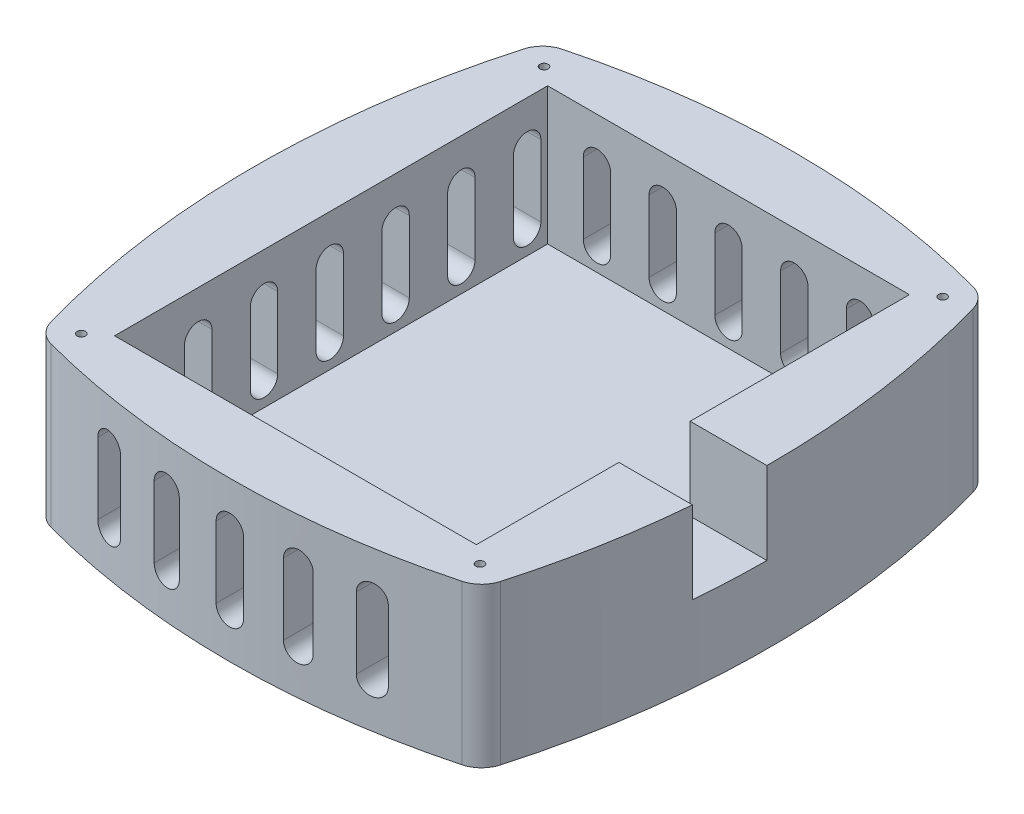
from build123d import *
from build123d.topology import SkipClean

# Parameters (mm, degrees)
SKETCH1_W                       = 66
SKETCH1_H                       = 79
BOSS_EXTRUDE1_DEPTH             = 4
SKETCH2_W                       = 74
SKETCH2_H                       = 87
SKETCH2_W_2                     = 66
SKETCH2_H_2                     = 79
BOSS_EXTRUDE2_DEPTH             = 29
SKETCH4_W                       = 74
SKETCH4_H                       = 87
BOSS_EXTRUDE4_DEPTH             = 29
SKETCH3_W                       = 16.198797776
SKETCH3_H                       = 13
CUT_EXTRUDE1_DEPTH              = 15
CUT_EXTRUDE2_DEPTH              = 93
CUT_EXTRUDE3_DEPTH              = 93
LPATTERN1_COUNT                 = 3
LPATTERN1_PITCH                 = 12
LPATTERN1_COL_COUNT             = 3
LPATTERN1_COL_PITCH             = 12
MIRROR1_COPY_1_DEPTH            = 93
MIRROR1_COPY_2_DEPTH            = 93
MIRROR1_COPY_3_DEPTH            = 93
MIRROR1_COPY_4_DEPTH            = 93
F_17_0_173_DIAMETER_HOLE1_D     = 1.500000048
F_17_0_173_DIAMETER_HOLE1_DEPTH = 10
F_17_0_173_DIAMETER_HOLE1_TIP   = 0.450645479


with BuildPart() as part:
    # Sketch1 → Boss-Extrude1 (new body)
    with BuildSketch(Plane(origin=(0, 0, 0), x_dir=(1, 0, 0), z_dir=(0, 1, 0))):
        with Locations((6.247484464, 10.574483927)):
            Rectangle(SKETCH1_W, SKETCH1_H)
    extrude(amount=BOSS_EXTRUDE1_DEPTH)

    # Sketch2 → Boss-Extrude2 (add)
    with BuildSketch(Plane.XZ):
        with Locations((6.247484464, -10.574483927)):
            Rectangle(SKETCH2_W, SKETCH2_H)
        with Locations((6.247484464, -10.574483927)):
            Rectangle(SKETCH2_W_2, SKETCH2_H_2, mode=Mode.SUBTRACT)
    extrude(amount=-BOSS_EXTRUDE2_DEPTH)

    # Sketch4 → Boss-Extrude4 (add)
    with BuildSketch(Plane.XZ):
        with BuildLine():
            ThreePointArc((-40.752515536, -10.574483927), (-39.245325003, 11.194253659), (-34.752515536, 32.547572429))
            ThreePointArc((-34.752515536, 32.547572429), (-33.449793102, 34.746088639), (-31.230871017, 36.013741608))
            ThreePointArc((-31.230871017, 36.013741608), (-12.651937868, 39.692344544), (6.247484464, 40.925516073))
            ThreePointArc((6.247484464, 40.925516073), (25.146906796, 39.692344544), (43.725839944, 36.013741608))
            ThreePointArc((43.725839944, 36.013741608), (45.944762029, 34.746088639), (47.247484464, 32.547572429))
            ThreePointArc((47.247484464, 32.547572429), (51.740293931, 11.194253659), (53.247484464, -10.574483927))
            ThreePointArc((53.247484464, -10.574483927), (51.740293931, -32.343221514), (47.247484464, -53.696540284))
            ThreePointArc((47.247484464, -53.696540284), (45.944762029, -55.895056494), (43.725839944, -57.162709463))
            ThreePointArc((43.725839944, -57.162709463), (25.146906796, -60.841312399), (6.247484464, -62.074483927))
            ThreePointArc((6.247484464, -62.074483927), (-12.651937868, -60.841312399), (-31.230871017, -57.162709463))
            ThreePointArc((-31.230871017, -57.162709463), (-33.449793102, -55.895056494), (-34.752515536, -53.696540284))
            ThreePointArc((-34.752515536, -53.696540284), (-39.245325003, -32.343221514), (-40.752515536, -10.574483927))
        make_face()
        with Locations((6.247484464, -10.574483927)):
            Rectangle(SKETCH4_W, SKETCH4_H, mode=Mode.SUBTRACT)
    extrude(amount=-BOSS_EXTRUDE4_DEPTH)

    # Sketch3 → Cut-Extrude1 (cut)
    with BuildSketch(Plane(origin=(0, 29, 0), x_dir=(1, 0, 0), z_dir=(0, 1, 0))):
        with Locations((47.346883352, 3.574483927)):
            Rectangle(SKETCH3_W, SKETCH3_H)
    extrude(amount=-CUT_EXTRUDE1_DEPTH, mode=Mode.SUBTRACT)

    # Sketch5 → Cut-Extrude2 (cut)
    with SkipClean():  # the faces are left unmerged after this step: merging them gives an invalid solid
        with BuildSketch(Plane(origin=(-26.752515536, 0, 0), x_dir=(0, 0, -1), z_dir=(1, 0, 0))):
            with BuildLine():
                Line((-16.162842009, 21.112906147), (-16.162842009, 8.112906147))
                ThreePointArc((-16.162842009, 8.112906147), (-13.662842009, 5.612906147), (-11.162842009, 8.112906147))
                Line((-11.162842009, 8.112906147), (-11.162842009, 21.112906147))
                ThreePointArc((-11.162842009, 21.112906147), (-13.662842009, 23.612906147), (-16.162842009, 21.112906147))
            make_face()
            with BuildLine():
                Line((-28.162842009, 21.112906147), (-28.162842009, 8.112906147))
                ThreePointArc((-28.162842009, 8.112906147), (-25.662842009, 5.612906147), (-23.162842009, 8.112906147))
                Line((-23.162842009, 8.112906147), (-23.162842009, 21.112906147))
                ThreePointArc((-23.162842009, 21.112906147), (-25.662842009, 23.612906147), (-28.162842009, 21.112906147))
            make_face()
            with BuildLine():
                Line((-4.162842009, 21.112906147), (-4.162842009, 8.112906147))
                ThreePointArc((-4.162842009, 8.112906147), (-1.662842009, 5.612906147), (0.837157991, 8.112906147))
                Line((0.837157991, 8.112906147), (0.837157991, 21.112906147))
                ThreePointArc((0.837157991, 21.112906147), (-1.662842009, 23.612906147), (-4.162842009, 21.112906147))
            make_face()
            with BuildLine():
                Line((7.837157991, 21.112906147), (7.837157991, 8.112906147))
                ThreePointArc((7.837157991, 8.112906147), (10.337157991, 5.612906147), (12.837157991, 8.112906147))
                Line((12.837157991, 8.112906147), (12.837157991, 21.112906147))
                ThreePointArc((12.837157991, 21.112906147), (10.337157991, 23.612906147), (7.837157991, 21.112906147))
            make_face()
            with BuildLine():
                Line((19.837157991, 21.112906147), (19.837157991, 8.112906147))
                ThreePointArc((19.837157991, 8.112906147), (22.337157991, 5.612906147), (24.837157991, 8.112906147))
                Line((24.837157991, 8.112906147), (24.837157991, 21.112906147))
                ThreePointArc((24.837157991, 21.112906147), (22.337157991, 23.612906147), (19.837157991, 21.112906147))
            make_face()
            with BuildLine():
                Line((31.837157991, 21.112906147), (31.837157991, 8.112906147))
                ThreePointArc((31.837157991, 8.112906147), (34.337157991, 5.612906147), (36.837157991, 8.112906147))
                Line((36.837157991, 8.112906147), (36.837157991, 21.112906147))
                ThreePointArc((36.837157991, 21.112906147), (34.337157991, 23.612906147), (31.837157991, 21.112906147))
            make_face()
            with BuildLine():
                Line((43.837157991, 21.112906147), (43.837157991, 8.112906147))
                ThreePointArc((43.837157991, 8.112906147), (46.337157991, 5.612906147), (48.837157991, 8.112906147))
                Line((48.837157991, 8.112906147), (48.837157991, 21.112906147))
                ThreePointArc((48.837157991, 21.112906147), (46.337157991, 23.612906147), (43.837157991, 21.112906147))
            make_face()
        extrude(amount=-CUT_EXTRUDE2_DEPTH, mode=Mode.SUBTRACT)

    # Sketch6 → Cut-Extrude3 (cut)
    with SkipClean():  # the faces are left unmerged after this step: merging them gives an invalid solid
        with BuildSketch(Plane(origin=(0, 0, 28.925516073), x_dir=(-1, 0, 0), z_dir=(0, 0, -1))):
            with BuildLine():
                Line((-3.747484464, 21), (-3.747484464, 8))
                ThreePointArc((-3.747484464, 8), (-6.247484464, 5.5), (-8.747484464, 8))
                Line((-8.747484464, 8), (-8.747484464, 21))
                ThreePointArc((-8.747484464, 21), (-6.247484464, 23.5), (-3.747484464, 21))
            make_face()
        cut_extrude3 = extrude(amount=-CUT_EXTRUDE3_DEPTH, mode=Mode.SUBTRACT)

    # LPattern1: Cut-Extrude3 ×3
    with SkipClean():  # the faces are left unmerged after this step: merging them gives an invalid solid
        with Locations(*[(i * LPATTERN1_PITCH, 0, 0) for i in range(1, LPATTERN1_COUNT)]):
            add(cut_extrude3, mode=Mode.SUBTRACT)

    # LPattern1 col: Cut-Extrude3 ×3
    with SkipClean():  # the faces are left unmerged after this step: merging them gives an invalid solid
        with Locations(*[(-i * LPATTERN1_COL_PITCH, 0, 0) for i in range(1, LPATTERN1_COL_COUNT)]):
            add(cut_extrude3, mode=Mode.SUBTRACT)

    # Mirror1: Cut-Extrude3 across plane
    with SkipClean():  # the faces are left unmerged after this step: merging them gives an invalid solid
        add(cut_extrude3.mirror(Plane.XY.offset(-10.574483927)), mode=Mode.SUBTRACT)

    # Mirror1 copy 1 sketch → Mirror1 copy 1 (cut)
    with SkipClean():  # the faces are left unmerged after this step: merging them gives an invalid solid
        with BuildSketch(Plane(origin=(12, 0, -50.074483927), x_dir=(-1, 0, 0), z_dir=(0, 0, 1))):
            with BuildLine():
                Line((-3.747484464, -21), (-3.747484464, -8))
                ThreePointArc((-3.747484464, -8), (-6.247484464, -5.5), (-8.747484464, -8))
                Line((-8.747484464, -8), (-8.747484464, -21))
                ThreePointArc((-8.747484464, -21), (-6.247484464, -23.5), (-3.747484464, -21))
            make_face()
        extrude(amount=-MIRROR1_COPY_1_DEPTH, mode=Mode.SUBTRACT)

    # Mirror1 copy 2 sketch → Mirror1 copy 2 (cut)
    with SkipClean():  # the faces are left unmerged after this step: merging them gives an invalid solid
        with BuildSketch(Plane(origin=(24, 0, -50.074483927), x_dir=(-1, 0, 0), z_dir=(0, 0, 1))):
            with BuildLine():
                Line((-3.747484464, -21), (-3.747484464, -8))
                ThreePointArc((-3.747484464, -8), (-6.247484464, -5.5), (-8.747484464, -8))
                Line((-8.747484464, -8), (-8.747484464, -21))
                ThreePointArc((-8.747484464, -21), (-6.247484464, -23.5), (-3.747484464, -21))
            make_face()
        extrude(amount=-MIRROR1_COPY_2_DEPTH, mode=Mode.SUBTRACT)

    # Mirror1 copy 3 sketch → Mirror1 copy 3 (cut)
    with SkipClean():  # the faces are left unmerged after this step: merging them gives an invalid solid
        with BuildSketch(Plane(origin=(-12, 0, -50.074483927), x_dir=(-1, 0, 0), z_dir=(0, 0, 1))):
            with BuildLine():
                Line((-3.747484464, -21), (-3.747484464, -8))
                ThreePointArc((-3.747484464, -8), (-6.247484464, -5.5), (-8.747484464, -8))
                Line((-8.747484464, -8), (-8.747484464, -21))
                ThreePointArc((-8.747484464, -21), (-6.247484464, -23.5), (-3.747484464, -21))
            make_face()
        extrude(amount=-MIRROR1_COPY_3_DEPTH, mode=Mode.SUBTRACT)

    # Mirror1 copy 4 sketch → Mirror1 copy 4 (cut)
    with SkipClean():  # the faces are left unmerged after this step: merging them gives an invalid solid
        with BuildSketch(Plane(origin=(-24, 0, -50.074483927), x_dir=(-1, 0, 0), z_dir=(0, 0, 1))):
            with BuildLine():
                Line((-3.747484464, -21), (-3.747484464, -8))
                ThreePointArc((-3.747484464, -8), (-6.247484464, -5.5), (-8.747484464, -8))
                Line((-8.747484464, -8), (-8.747484464, -21))
                ThreePointArc((-8.747484464, -21), (-6.247484464, -23.5), (-3.747484464, -21))
            make_face()
        extrude(amount=-MIRROR1_COPY_4_DEPTH, mode=Mode.SUBTRACT)

    # #17 (0.173) Diameter Hole1
    with Locations(Plane(origin=(0, 29, 0), x_dir=(1, 0, 0), z_dir=(0, 1, 0))):
        with Locations((-30.117152291, 52.779712436), (-30.117152291, -31.630744581), (42.612121218, -31.630744581), (42.612121218, 52.779712436)):
            Hole(F_17_0_173_DIAMETER_HOLE1_D / 2, depth=F_17_0_173_DIAMETER_HOLE1_DEPTH)
            with Locations((0, 0, -(F_17_0_173_DIAMETER_HOLE1_DEPTH + F_17_0_173_DIAMETER_HOLE1_TIP / 2))):  # 118° drill point
                Cone(0, F_17_0_173_DIAMETER_HOLE1_D / 2, F_17_0_173_DIAMETER_HOLE1_TIP, mode=Mode.SUBTRACT)


solid = part.part
